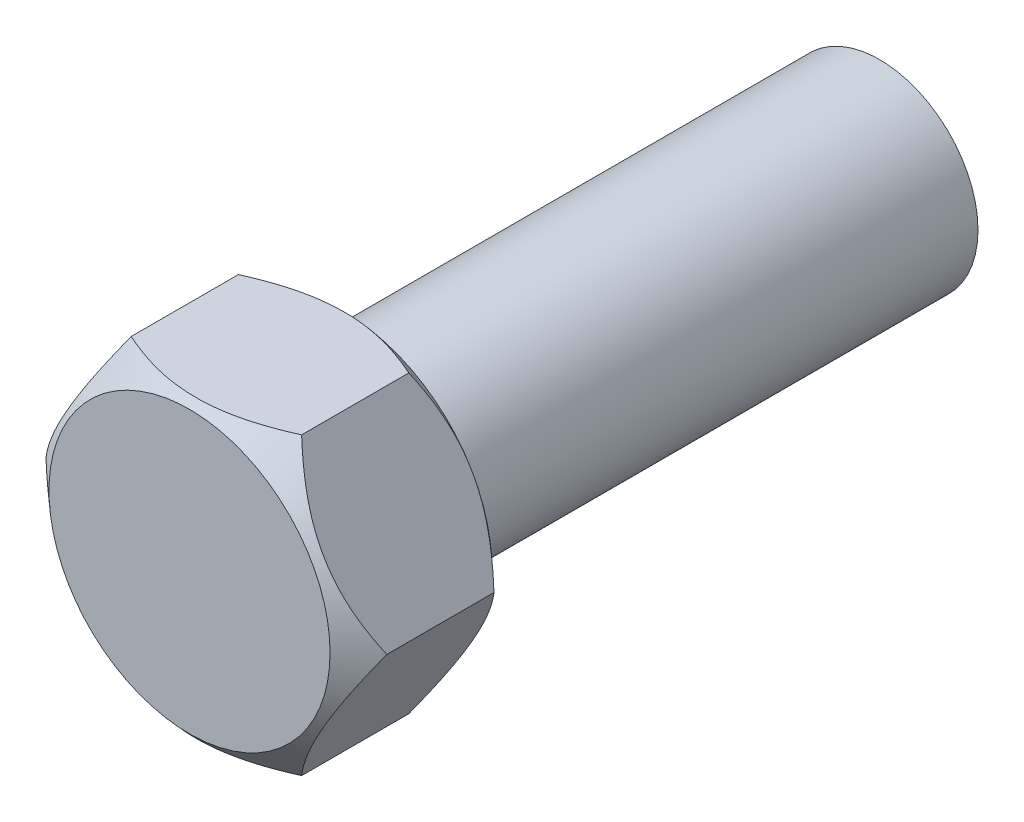
from build123d import *

# Parameters (mm, degrees)
CROQUIS1_R              = 7
SALIENTE_EXTRUIR1_DEPTH = 38.1
SALIENTE_EXTRUIR2_DEPTH = 11
CROQUIS3_R              = 27.5
CROQUIS3_R_2            = 10
CORTAR_EXTRUIR1_DEPTH   = 8
CORTAR_EXTRUIR1_DRAFT   = -48
CROQUIS4_R              = 37.959799744
CROQUIS4_R_2            = 10.5
CORTAR_EXTRUIR2_DEPTH   = 11
CORTAR_EXTRUIR2_DRAFT   = -48


with BuildPart() as part:
    # Croquis1 → Saliente-Extruir1 (new body)
    with BuildSketch(Plane.XY):
        with Locations(Location((0, 0, 0), (0, 0, 180))):
            Circle(CROQUIS1_R)
    extrude(amount=SALIENTE_EXTRUIR1_DEPTH)

    # Croquis2 → Saliente-Extruir2 (add)
    with BuildSketch(Plane.XY.offset(38.1)):
        Polygon((12.124355653, 0), (6.062177826, 10.5), (-6.062177826, 10.5), (-12.124355653, 0), (-6.062177826, -10.5), (6.062177826, -10.5), align=None)
    extrude(amount=SALIENTE_EXTRUIR2_DEPTH)


with BuildPart() as cortar_extruir1_tool:
    # Croquis3 → Cortar-Extruir1 (with draft: the straight prism first)
    with BuildSketch(Plane.XY.offset(49.1)):
        Circle(CROQUIS3_R)
        Circle(CROQUIS3_R_2, mode=Mode.SUBTRACT)
    extrude(amount=-CORTAR_EXTRUIR1_DEPTH)
    # Cortar-Extruir1: the draft: its side faces are tilted about the plane it starts from
    cortar_extruir1_sides = [cortar_extruir1_tool.faces().sort_by_distance(p)[0] for p in [
        (-27.5, 0, 45.1),
        (-10, 0, 45.1),
    ]]
    draft(cortar_extruir1_sides, Plane.XY.offset(49.1), CORTAR_EXTRUIR1_DRAFT)


with BuildPart() as part_1:
    add(part.part)

    # Cortar-Extruir1: cut by cortar_extruir1_tool
    add(cortar_extruir1_tool.part, mode=Mode.SUBTRACT)


with BuildPart() as cortar_extruir2_tool:
    # Croquis4 → Cortar-Extruir2 (with draft: the straight prism first)
    with BuildSketch(Plane(origin=(0, 0, 38.1), x_dir=(-1, 0, 0), z_dir=(0, 0, -1))):
        Circle(CROQUIS4_R)
        Circle(CROQUIS4_R_2, mode=Mode.SUBTRACT)
    extrude(amount=-CORTAR_EXTRUIR2_DEPTH)
    # Cortar-Extruir2: the draft: its side faces are tilted about the plane it starts from
    cortar_extruir2_sides = [cortar_extruir2_tool.faces().sort_by_distance(p)[0] for p in [
        (37.959799744, 0, 43.6),
        (10.5, 0, 43.6),
    ]]
    draft(cortar_extruir2_sides, Plane(origin=(0, 0, 38.1), x_dir=(-1, 0, 0), z_dir=(0, 0, -1)), CORTAR_EXTRUIR2_DRAFT)


with BuildPart() as part_2:
    add(part_1.part)

    # Cortar-Extruir2: cut by cortar_extruir2_tool
    add(cortar_extruir2_tool.part, mode=Mode.SUBTRACT)


solid = part_2.part
